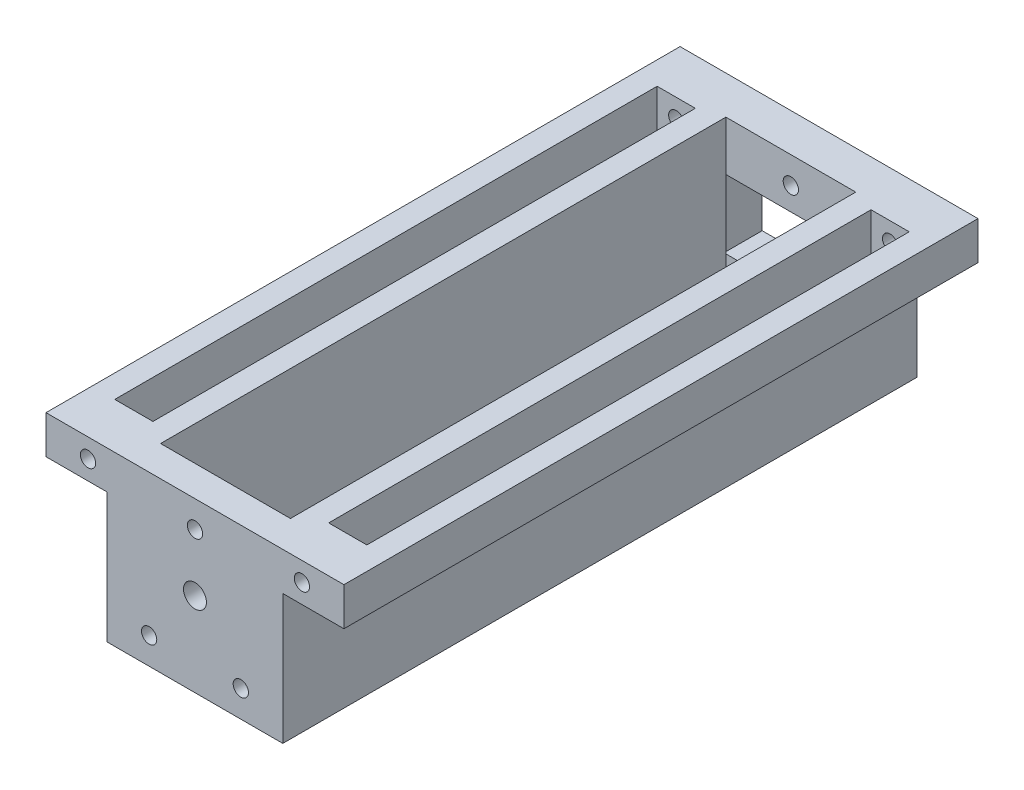
from build123d import *

# Parameters (mm, degrees)
SKETCH1_R           = 12.7
BOSS_EXTRUDE1_DEPTH = 63.5
BOSS_EXTRUDE2_REACH = 323.601
SKETCH2_W           = 38.1
SKETCH2_H           = 939.8
SKETCH3_W           = 38.1
SKETCH3_H           = 279.4
SKETCH3_W_2         = 215.9
SKETCH3_R           = 12.7
BOSS_EXTRUDE3_DEPTH = 50.8
CUT_EXTRUDE1_REACH  = 1075.3
SKETCH4_R           = 19.05
SKETCH5_W           = 38.1
SKETCH5_H           = 63.5
SKETCH5_W_2         = 63.5
SKETCH5_R           = 12.7
BOSS_EXTRUDE4_DEPTH = 76.2
BOSS_EXTRUDE5_START = -977.9
SKETCH5_3_W         = 38.1
SKETCH5_3_H         = 63.5
SKETCH5_3_W_2       = 63.5
SKETCH5_3_R         = 12.7
BOSS_EXTRUDE5_DEPTH = 76.2
BOSS_EXTRUDE6_START = -977.9
SKETCH5_4_W         = 38.1
SKETCH5_4_H         = 63.5
BOSS_EXTRUDE6_DEPTH = 901.7


with BuildPart() as part:
    # Sketch1 → Boss-Extrude1 (new body)
    with BuildSketch(Plane.XY):
        Polygon((146.05, 139.7), (-146.05, 139.7), (-146.05, -139.7), (-44.45, -139.7), (-44.45, -57.15), (-111.125, -57.15), (-111.125, 57.15), (111.125, 57.15), (111.125, -57.15), (44.45, -57.15), (44.45, -139.7), (146.05, -139.7), align=None)
        with Locations((-76.2, -95.25)):
            Circle(SKETCH1_R, mode=Mode.SUBTRACT)
        with Locations((76.2, -95.25)):
            Circle(SKETCH1_R, mode=Mode.SUBTRACT)
        with Locations((0, 95.25)):
            Circle(SKETCH1_R, mode=Mode.SUBTRACT)
    extrude(amount=BOSS_EXTRUDE1_DEPTH)

    # Boss-Extrude2: up to this face of the body (flat: up to its plane)
    boss_extrude2_end = Plane(part.part.faces().sort_by_distance((-95.25, -139.7, 31.75))[0])
    # Sketch2 → Boss-Extrude2 (add, up to the picked face)
    with BuildSketch(Plane(origin=(0, 139.7, 0), x_dir=(1, 0, 0), z_dir=(0, 1, 0)), mode=Mode.PRIVATE) as boss_extrude2_sk1:
        with Locations((-127, -533.4)):
            Rectangle(SKETCH2_W, SKETCH2_H)
    boss_extrude2_tool1 = split(extrude(boss_extrude2_sk1.sketch, amount=-BOSS_EXTRUDE2_REACH, mode=Mode.PRIVATE), bisect_by=boss_extrude2_end, keep=Keep.BOTH, mode=Mode.PRIVATE)
    # Sketch2 → Boss-Extrude2 (add, up to the picked face)
    with BuildSketch(Plane(origin=(0, 139.7, 0), x_dir=(1, 0, 0), z_dir=(0, 1, 0)), mode=Mode.PRIVATE) as boss_extrude2_sk2:
        with Locations((127, -533.4)):
            Rectangle(SKETCH2_W, SKETCH2_H)
    boss_extrude2_tool2 = split(extrude(boss_extrude2_sk2.sketch, amount=-BOSS_EXTRUDE2_REACH, mode=Mode.PRIVATE), bisect_by=boss_extrude2_end, keep=Keep.BOTH, mode=Mode.PRIVATE)
    add(boss_extrude2_tool1.solids().sort_by(Axis((-127, 139.7, 533.4), (0, -1, 0)))[0])
    add(boss_extrude2_tool2.solids().sort_by(Axis((127, 139.7, 533.4), (0, -1, 0)))[0])

    # Sketch3 → Boss-Extrude3 (add)
    # profile 1 of 3: a face of its own
    with BuildSketch(Plane.XY.offset(1003.3)):
        with Locations((-127, 0)):
            Rectangle(SKETCH3_W, SKETCH3_H)
    # profile 2 of 3: a face of its own
    with BuildSketch(Plane.XY.offset(1003.3)):
        Rectangle(SKETCH3_W_2, SKETCH3_H)
        with Locations((-76.2, -95.25)):
            Circle(SKETCH3_R, mode=Mode.SUBTRACT)
        with Locations((76.2, -95.25)):
            Circle(SKETCH3_R, mode=Mode.SUBTRACT)
        with Locations((0, 95.25)):
            Circle(SKETCH3_R, mode=Mode.SUBTRACT)
    # profile 3 of 3: a face of its own
    with BuildSketch(Plane.XY.offset(1003.3)):
        with Locations((127, 0)):
            Rectangle(SKETCH3_W, SKETCH3_H)
    extrude(amount=BOSS_EXTRUDE3_DEPTH)

    # Sketch4 → Cut-Extrude1 (cut, up to next)
    with BuildSketch(Plane.XY.offset(1054.1), mode=Mode.PRIVATE) as cut_extrude1_sk1:
        Circle(SKETCH4_R)
    cut_extrude1_tool1 = extrude(cut_extrude1_sk1.sketch, amount=-CUT_EXTRUDE1_REACH, mode=Mode.PRIVATE) & part.part
    add(cut_extrude1_tool1.solids().sort_by_distance((0, 0, 1054.1))[0], mode=Mode.SUBTRACT)

    # Sketch5 → Boss-Extrude4 (add)
    # profile 1 of 4: a face of its own
    with BuildSketch(Plane.XY.offset(1054.1)):
        with Locations((228.6, 107.95)):
            Rectangle(SKETCH5_W, SKETCH5_H)
    # profile 2 of 4: a face of its own
    with BuildSketch(Plane.XY.offset(1054.1)):
        with Locations((177.8, 107.95)):
            Rectangle(SKETCH5_W_2, SKETCH5_H)
        with Locations((177.8, 107.95)):
            Circle(SKETCH5_R, mode=Mode.SUBTRACT)
    # profile 3 of 4: a face of its own
    with BuildSketch(Plane.XY.offset(1054.1)):
        with Locations((-228.6, 107.95)):
            Rectangle(SKETCH5_W, SKETCH5_H)
    # profile 4 of 4: a face of its own
    with BuildSketch(Plane.XY.offset(1054.1)):
        with Locations((-177.8, 107.95)):
            Rectangle(SKETCH5_W_2, SKETCH5_H)
        with Locations((-177.8, 107.95)):
            Circle(SKETCH5_R, mode=Mode.SUBTRACT)
    extrude(amount=-BOSS_EXTRUDE4_DEPTH)

    # Sketch5<3> → Boss-Extrude5 (add)
    # profile 1 of 4: a face of its own
    with BuildSketch(Plane.XY.offset(1054.1).offset(BOSS_EXTRUDE5_START)):
        with Locations((228.6, 107.95)):
            Rectangle(SKETCH5_3_W, SKETCH5_3_H)
    # profile 2 of 4: a face of its own
    with BuildSketch(Plane.XY.offset(1054.1).offset(BOSS_EXTRUDE5_START)):
        with Locations((177.8, 107.95)):
            Rectangle(SKETCH5_3_W_2, SKETCH5_3_H)
        with Locations((177.8, 107.95)):
            Circle(SKETCH5_3_R, mode=Mode.SUBTRACT)
    # profile 3 of 4: a face of its own
    with BuildSketch(Plane.XY.offset(1054.1).offset(BOSS_EXTRUDE5_START)):
        with Locations((-228.6, 107.95)):
            Rectangle(SKETCH5_3_W, SKETCH5_3_H)
    # profile 4 of 4: a face of its own
    with BuildSketch(Plane.XY.offset(1054.1).offset(BOSS_EXTRUDE5_START)):
        with Locations((-177.8, 107.95)):
            Rectangle(SKETCH5_3_W_2, SKETCH5_3_H)
        with Locations((-177.8, 107.95)):
            Circle(SKETCH5_3_R, mode=Mode.SUBTRACT)
    extrude(amount=-BOSS_EXTRUDE5_DEPTH)

    # Sketch5<4> → Boss-Extrude6 (add)
    with BuildSketch(Plane.XY.offset(1054.1).offset(BOSS_EXTRUDE6_START)):
        with Locations((-228.6, 107.95)):
            Rectangle(SKETCH5_4_W, SKETCH5_4_H)
        with Locations((228.6, 107.95)):
            Rectangle(SKETCH5_4_W, SKETCH5_4_H)
    extrude(amount=BOSS_EXTRUDE6_DEPTH)


solid = part.part
